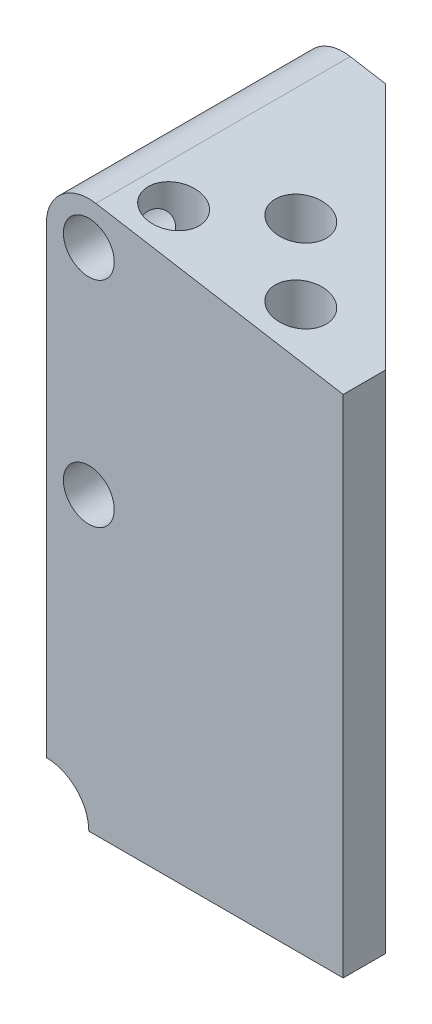
from build123d import *

# Parameters (mm, degrees)
SKETCH1_W           = 20
SKETCH1_H           = 130
SKETCH1_R           = 2.5
BOSS_EXTRUDE1_DEPTH = 60
BOSS_EXTRUDE2_DEPTH = 130
CUT_EXTRUDE2_DEPTH  = 156.241746963
CUT_EXTRUDE3_DEPTH  = 25
SKETCH5_R           = 10
CUT_EXTRUDE4_DEPTH  = 147.694623422
SKETCH6_R           = 6
CUT_EXTRUDE8_DEPTH  = 55
SKETCH7_R           = 2.5
CUT_EXTRUDE9_DEPTH  = 5
SKETCH9_R           = 6
CUT_EXTRUDE10_DEPTH = 151.423561372


with BuildPart() as part:
    # Sketch1 → Boss-Extrude1 (new body)
    with BuildSketch(Plane.XY):
        with Locations((0, 65)):
            Rectangle(SKETCH1_W, SKETCH1_H)
        with Locations((0, 119.20647252)):
            Circle(SKETCH1_R, mode=Mode.SUBTRACT)
        with Locations((0, 68.70647252)):
            Circle(SKETCH1_R, mode=Mode.SUBTRACT)
    extrude(amount=BOSS_EXTRUDE1_DEPTH)

    # Sketch2 → Boss-Extrude2 (add)
    with BuildSketch(Plane(origin=(0, 130, 0), x_dir=(1, 0, 0), z_dir=(0, 1, 0))):
        Polygon((10, 0), (60, -50), (60, -60), (10, -60), align=None)
    extrude(amount=-BOSS_EXTRUDE2_DEPTH)

    # Sketch4 → Cut-Extrude2 (cut, through all)
    with BuildSketch(Plane(origin=(0, 0, 0), x_dir=(-1, 0, 0), z_dir=(0, 0, -1))):
        with BuildLine():
            ThreePointArc((-1.666666667, 129.066605492), (6.454972244, 126.844098678), (10, 119.20647252))
            Line((10, 119.20647252), (10, 130))
            Line((10, 130), (-10, 130))
            Line((-10, 130), (-10, 127.658015067))
            Line((-10, 127.658015067), (-1.666666667, 129.066605492))
        make_face()
        Polygon((-60, 130), (-60, 119.20647252), (-10, 127.658015067), (-10, 130), align=None)
    extrude(amount=-CUT_EXTRUDE2_DEPTH, mode=Mode.SUBTRACT)

    # Sketch4<5> → Cut-Extrude3 (cut)
    with BuildSketch(Plane(origin=(0, 0, 0), x_dir=(-1, 0, 0), z_dir=(0, 0, -1))):
        with BuildLine():
            Line((10, 0), (10, 68.70647252))
            ThreePointArc((10, 68.70647252), (6.454972244, 61.068846362), (-1.666666667, 58.846339548))
            Line((-1.666666667, 58.846339548), (-10, 60.254929973))
            Line((-10, 60.254929973), (-10, 0))
            Line((-10, 0), (10, 0))
        make_face()
        Polygon((-10, 60.254929973), (-60, 68.70647252), (-60, 0), (-10, 0), align=None)
    extrude(amount=-CUT_EXTRUDE3_DEPTH, mode=Mode.SUBTRACT)

    # Sketch5 → Cut-Extrude4 (cut, through all)
    with BuildSketch(Plane(origin=(0, 0, 25), x_dir=(-1, 0, 0), z_dir=(0, 0, -1))):
        with Locations((10, 0)):
            Circle(SKETCH5_R)
    extrude(amount=-CUT_EXTRUDE4_DEPTH, mode=Mode.SUBTRACT)

    # Sketch6 → Cut-Extrude8 (cut)
    with BuildSketch(Plane.XY.offset(60)):
        with Locations((0, 119.20647252)):
            Circle(SKETCH6_R)
        with Locations((0, 68.70647252)):
            Circle(SKETCH6_R)
    extrude(amount=-CUT_EXTRUDE8_DEPTH, mode=Mode.SUBTRACT)

    # Sketch7 → Cut-Extrude9 (cut)
    with BuildSketch(Plane.XZ):
        with Locations(Location((10, 50, 0), (0, 0, 270))):
            Circle(SKETCH7_R)
        with Locations(Location((40, 50, 0), (0, 0, 270))):
            Circle(SKETCH7_R)
        with Locations(Location((25, 35, 0), (0, 0, 270))):
            Circle(SKETCH7_R)
    extrude(amount=-CUT_EXTRUDE9_DEPTH, mode=Mode.SUBTRACT)

    # Sketch9 → Cut-Extrude10 (cut, through all)
    with BuildSketch(Plane.XZ.offset(-5)):
        with Locations(Location((10, 50, 0), (0, 0, 270))):
            Circle(SKETCH9_R)
        with Locations(Location((25, 35, 0), (0, 0, 270))):
            Circle(SKETCH9_R)
        with Locations(Location((40, 50, 0), (0, 0, 270))):
            Circle(SKETCH9_R)
    extrude(amount=-CUT_EXTRUDE10_DEPTH, mode=Mode.SUBTRACT)


solid = part.part
